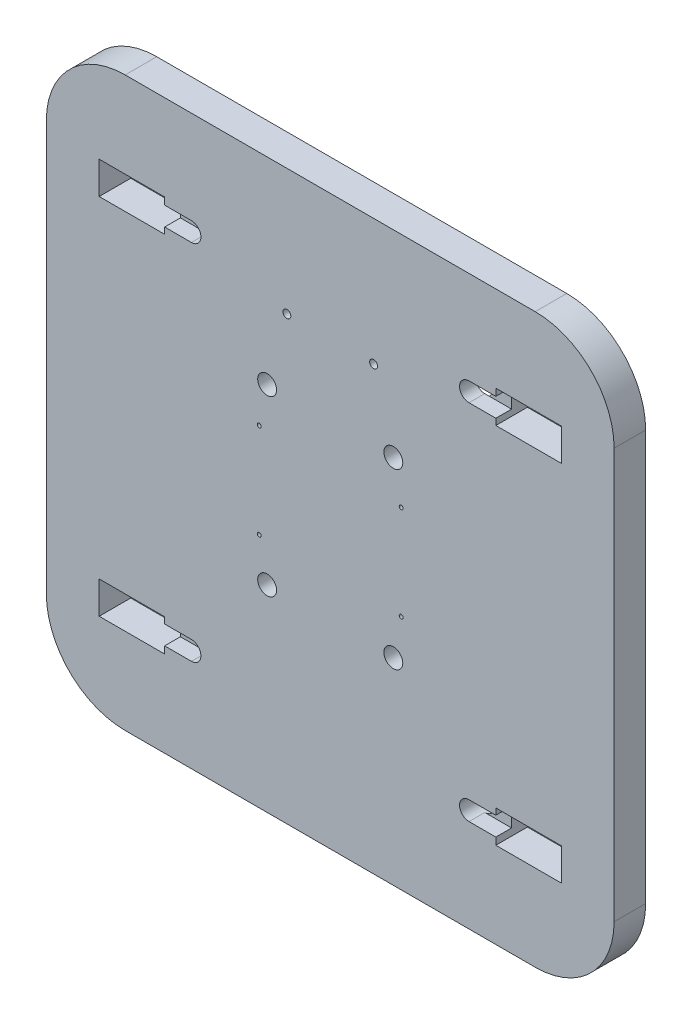
from build123d import *

# Parameters (mm, degrees)
BOSS_EXTRUDE1_DEPTH = 10
SKETCH2_W           = 41.5
SKETCH2_H           = 20.5
CUT_EXTRUDE1_DEPTH  = 20
SKETCH3_R           = 6
CUT_EXTRUDE2_DEPTH  = 510.509568114
SKETCH4_R           = 6
CUT_EXTRUDE3_DEPTH  = 510.509568114
CUT_EXTRUDE4_DEPTH  = 10
SKETCH11_W          = 20.354372897
SKETCH11_H          = 12
SKETCH11_W_2        = 24.350914836
SKETCH11_W_3        = 29.997295682
CUT_EXTRUDE5_DEPTH  = 10
M3_TAPPED_HOLE1_D   = 2.5
M6_TAPPED_HOLE1_D   = 5


with BuildPart() as part:
    # Sketch1 → Boss-Extrude1 (new, symmetric)
    with BuildSketch(Plane.XY):
        with BuildLine():
            Line((50, 360), (310, 360))
            ThreePointArc((310, 360), (345.355339059, 345.355339059), (360, 310))
            Line((360, 310), (360, 50))
            ThreePointArc((360, 50), (345.355339059, 14.644660941), (310, 0))
            Line((310, 0), (50, 0))
            ThreePointArc((50, 0), (14.644660941, 14.644660941), (0, 50))
            Line((0, 50), (0, 310))
            ThreePointArc((0, 310), (14.644660941, 345.355339059), (50, 360))
        make_face()
    extrude(amount=BOSS_EXTRUDE1_DEPTH, both=True)

    # Sketch2 → Cut-Extrude1 (cut)
    with BuildSketch(Plane.XY.offset(10)):
        with Locations((54.25, 295.25)):
            Rectangle(SKETCH2_W, SKETCH2_H)
        with Locations((305.75, 295.25)):
            Rectangle(SKETCH2_W, SKETCH2_H)
        with Locations((305.75, 64.75)):
            Rectangle(SKETCH2_W, SKETCH2_H)
        with Locations((54.25, 64.75)):
            Rectangle(SKETCH2_W, SKETCH2_H)
    extrude(amount=-CUT_EXTRUDE1_DEPTH, mode=Mode.SUBTRACT)

    # Sketch3 → Cut-Extrude2 (cut, through all)
    with BuildSketch(Plane.XY.offset(10)):
        with Locations((92, 295)):
            Circle(SKETCH3_R)
        with Locations((268, 295)):
            Circle(SKETCH3_R)
        with Locations((268, 65)):
            Circle(SKETCH3_R)
        with Locations((92, 65)):
            Circle(SKETCH3_R)
    extrude(amount=-CUT_EXTRUDE2_DEPTH, mode=Mode.SUBTRACT)

    # Sketch4 → Cut-Extrude3 (cut, through all)
    with BuildSketch(Plane.XY.offset(10)):
        with Locations((140, 235)):
            Circle(SKETCH4_R)
        with Locations((220, 235)):
            Circle(SKETCH4_R)
        with Locations((220, 125)):
            Circle(SKETCH4_R)
        with Locations((140, 125)):
            Circle(SKETCH4_R)
    extrude(amount=-CUT_EXTRUDE3_DEPTH, mode=Mode.SUBTRACT)

    # Sketch10 → Cut-Extrude4 (cut)
    with BuildSketch(Plane(origin=(0, 0, -10), x_dir=(-1, 0, 0), z_dir=(0, 0, -1))):
        Polygon((-87.314787143, 291.251829715), (-135.314787143, 231.251829715), (-144.685212857, 238.748170285), (-96.685212857, 298.748170285), align=None)
        Polygon((-263.314787143, 61.251829715), (-215.314787143, 121.251829715), (-224.685212857, 128.748170285), (-272.685212857, 68.748170285), align=None)
        Polygon((-87.314787143, 68.748170285), (-135.314787143, 128.748170285), (-144.685212857, 121.251829715), (-96.685212857, 61.251829715), align=None)
        Polygon((-272.685212857, 291.251829715), (-224.685212857, 231.251829715), (-215.314787143, 238.748170285), (-263.314787143, 298.748170285), align=None)
    extrude(amount=-CUT_EXTRUDE4_DEPTH, mode=Mode.SUBTRACT)

    # Sketch11 → Cut-Extrude5 (cut)
    with BuildSketch(Plane.XY.offset(10)):
        with Locations((81.822813552, 65)):
            Rectangle(SKETCH11_W, SKETCH11_H)
        with Locations((280.175457418, 65)):
            Rectangle(SKETCH11_W_2, SKETCH11_H)
        with Locations((280.175457418, 295)):
            Rectangle(SKETCH11_W_2, SKETCH11_H)
        with Locations((77.001352159, 295)):
            Rectangle(SKETCH11_W_3, SKETCH11_H)
    extrude(amount=-CUT_EXTRUDE5_DEPTH, mode=Mode.SUBTRACT)

    # M3 Tapped Hole1 (through all)
    with Locations(Plane(origin=(135, 150, 10), x_dir=(1, 0, 0), z_dir=(0, 0, 1))):
        with Locations((0, 0), (90, 60), (0, 60), (90, 0)):
            Hole(M3_TAPPED_HOLE1_D / 2)

    # M6 Tapped Hole1 (through all)
    with Locations(Plane(origin=(152.5, 280, 10), x_dir=(1, 0, 0), z_dir=(0, 0, 1))):
        with Locations((0, 0), (55, 0)):
            Hole(M6_TAPPED_HOLE1_D / 2)


solid = part.part
